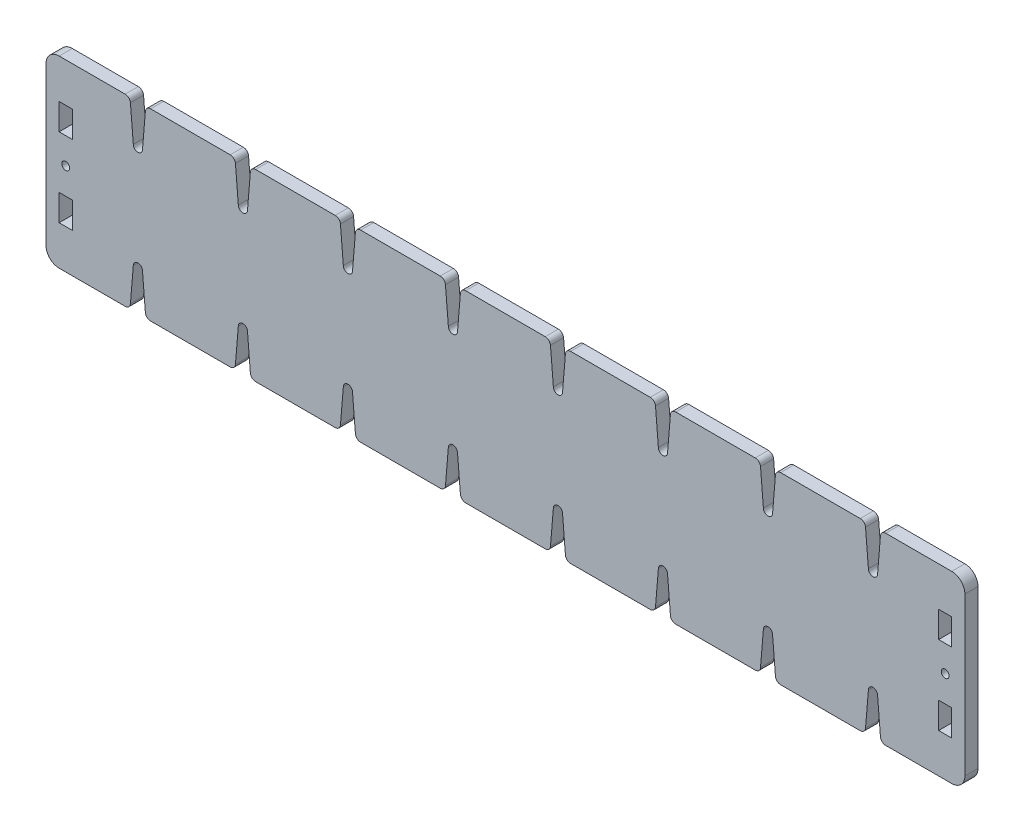
from build123d import *

# Parameters (mm, degrees)
SKETCH1_W           = 350
SKETCH1_H           = 70
SKETCH1_R           = 1.5
SKETCH1_W_2         = 5
SKETCH1_H_2         = 10
BOSS_EXTRUDE1_DEPTH = 5
CUT_EXTRUDE1_DEPTH  = 5
FILLET1_R           = 2
CONG_1_R            = 5


with BuildPart() as part:
    # Sketch1 → Boss-Extrude1 (new body)
    with BuildSketch(Plane.XY):
        with Locations((89.186746988, 0)):
            Rectangle(SKETCH1_W, SKETCH1_H)
        with Locations((-78.313253012, 0)):
            Circle(SKETCH1_R, mode=Mode.SUBTRACT)
        with Locations(Location((256.686746988, 0, 0), (0, 0, 180))):
            Circle(SKETCH1_R, mode=Mode.SUBTRACT)
        with Locations((-78.313253012, -15)):
            Rectangle(SKETCH1_W_2, SKETCH1_H_2, mode=Mode.SUBTRACT)
        with Locations((-78.313253012, 15)):
            Rectangle(SKETCH1_W_2, SKETCH1_H_2, mode=Mode.SUBTRACT)
        with Locations((256.686746988, -15)):
            Rectangle(SKETCH1_W_2, SKETCH1_H_2, mode=Mode.SUBTRACT)
        with Locations((256.686746988, 15)):
            Rectangle(SKETCH1_W_2, SKETCH1_H_2, mode=Mode.SUBTRACT)
    extrude(amount=BOSS_EXTRUDE1_DEPTH)

    # Sketch2 → Cut-Extrude1 (cut)
    with BuildSketch(Plane.XY.offset(5)):
        with BuildLine():
            Line((-53.813253012, 35), (-47.813253012, 35))
            Line((-47.813253012, 35), (-49.063253012, 20))
            ThreePointArc((-49.063253012, 20), (-50.813253012, 18.25), (-52.563253012, 20))
            Line((-52.563253012, 20), (-53.813253012, 35))
        make_face()
        with BuildLine():
            Line((-13.813253012, 35), (-7.813253012, 35))
            Line((-7.813253012, 35), (-9.063253012, 20))
            ThreePointArc((-9.063253012, 20), (-10.813253012, 18.25), (-12.563253012, 20))
            Line((-12.563253012, 20), (-13.813253012, 35))
        make_face()
        with BuildLine():
            Line((26.186746988, 35), (32.186746988, 35))
            Line((32.186746988, 35), (30.936746988, 20))
            ThreePointArc((30.936746988, 20), (29.186746988, 18.25), (27.436746988, 20))
            Line((27.436746988, 20), (26.186746988, 35))
        make_face()
        with BuildLine():
            Line((66.186746988, 35), (72.186746988, 35))
            Line((72.186746988, 35), (70.936746988, 20))
            ThreePointArc((70.936746988, 20), (69.186746988, 18.25), (67.436746988, 20))
            Line((67.436746988, 20), (66.186746988, 35))
        make_face()
        with BuildLine():
            Line((106.186746988, 35), (112.186746988, 35))
            Line((112.186746988, 35), (110.936746988, 20))
            ThreePointArc((110.936746988, 20), (109.186746988, 18.25), (107.436746988, 20))
            Line((107.436746988, 20), (106.186746988, 35))
        make_face()
        with BuildLine():
            Line((146.186746988, 35), (152.186746988, 35))
            Line((152.186746988, 35), (150.936746988, 20))
            ThreePointArc((150.936746988, 20), (149.186746988, 18.25), (147.436746988, 20))
            Line((147.436746988, 20), (146.186746988, 35))
        make_face()
        with BuildLine():
            Line((186.186746988, 35), (192.186746988, 35))
            Line((192.186746988, 35), (190.936746988, 20))
            ThreePointArc((190.936746988, 20), (189.186746988, 18.25), (187.436746988, 20))
            Line((187.436746988, 20), (186.186746988, 35))
        make_face()
        with BuildLine():
            Line((226.186746988, 35), (232.186746988, 35))
            Line((232.186746988, 35), (230.936746988, 20))
            ThreePointArc((230.936746988, 20), (229.186746988, 18.25), (227.436746988, 20))
            Line((227.436746988, 20), (226.186746988, 35))
        make_face()
        with BuildLine():
            Line((232.186746988, -35), (230.936746988, -20))
            ThreePointArc((230.936746988, -20), (229.186746988, -18.25), (227.436746988, -20))
            Line((227.436746988, -20), (226.186746988, -35))
            Line((226.186746988, -35), (232.186746988, -35))
        make_face()
        with BuildLine():
            Line((192.186746988, -35), (190.936746988, -20))
            ThreePointArc((190.936746988, -20), (189.186746988, -18.25), (187.436746988, -20))
            Line((187.436746988, -20), (186.186746988, -35))
            Line((186.186746988, -35), (192.186746988, -35))
        make_face()
        with BuildLine():
            Line((152.186746988, -35), (150.936746988, -20))
            ThreePointArc((150.936746988, -20), (149.186746988, -18.25), (147.436746988, -20))
            Line((147.436746988, -20), (146.186746988, -35))
            Line((146.186746988, -35), (152.186746988, -35))
        make_face()
        with BuildLine():
            Line((112.186746988, -35), (110.936746988, -20))
            ThreePointArc((110.936746988, -20), (109.186746988, -18.25), (107.436746988, -20))
            Line((107.436746988, -20), (106.186746988, -35))
            Line((106.186746988, -35), (112.186746988, -35))
        make_face()
        with BuildLine():
            Line((72.186746988, -35), (70.936746988, -20))
            ThreePointArc((70.936746988, -20), (69.186746988, -18.25), (67.436746988, -20))
            Line((67.436746988, -20), (66.186746988, -35))
            Line((66.186746988, -35), (72.186746988, -35))
        make_face()
        with BuildLine():
            Line((32.186746988, -35), (30.936746988, -20))
            ThreePointArc((30.936746988, -20), (29.186746988, -18.25), (27.436746988, -20))
            Line((27.436746988, -20), (26.186746988, -35))
            Line((26.186746988, -35), (32.186746988, -35))
        make_face()
        with BuildLine():
            Line((-7.813253012, -35), (-9.063253012, -20))
            ThreePointArc((-9.063253012, -20), (-10.813253012, -18.25), (-12.563253012, -20))
            Line((-12.563253012, -20), (-13.813253012, -35))
            Line((-13.813253012, -35), (-7.813253012, -35))
        make_face()
        with BuildLine():
            Line((-47.813253012, -35), (-49.063253012, -20))
            ThreePointArc((-49.063253012, -20), (-50.813253012, -18.25), (-52.563253012, -20))
            Line((-52.563253012, -20), (-53.813253012, -35))
            Line((-53.813253012, -35), (-47.813253012, -35))
        make_face()
    extrude(amount=-CUT_EXTRUDE1_DEPTH, mode=Mode.SUBTRACT)

    # Fillet1
    fillet1_edges = [part.edges().sort_by_distance(p)[0] for p in [
        (-13.813253012, 35, 2.5),
        (-7.813253012, 35, 2.5),
        (26.186746988, 35, 2.5),
        (32.186746988, 35, 2.5),
        (66.186746988, 35, 2.5),
        (72.186746988, 35, 2.5),
        (106.186746988, 35, 2.5),
        (112.186746988, 35, 2.5),
        (146.186746988, 35, 2.5),
        (152.186746988, 35, 2.5),
        (186.186746988, 35, 2.5),
        (192.186746988, 35, 2.5),
        (226.186746988, 35, 2.5),
        (232.186746988, 35, 2.5),
        (232.186746988, -35, 2.5),
        (226.186746988, -35, 2.5),
        (192.186746988, -35, 2.5),
        (186.186746988, -35, 2.5),
        (152.186746988, -35, 2.5),
        (146.186746988, -35, 2.5),
        (112.186746988, -35, 2.5),
        (106.186746988, -35, 2.5),
        (72.186746988, -35, 2.5),
        (66.186746988, -35, 2.5),
        (32.186746988, -35, 2.5),
        (26.186746988, -35, 2.5),
        (-7.813253012, -35, 2.5),
        (-13.813253012, -35, 2.5),
        (-47.813253012, -35, 2.5),
        (-53.813253012, -35, 2.5),
        (-53.813253012, 35, 2.5),
        (-47.813253012, 35, 2.5),
    ]]
    fillet(fillet1_edges, radius=FILLET1_R)

    # Congé1
    cong_1_edges = [part.edges().sort_by_distance(p)[0] for p in [
        (-85.813253012, 35, 2.5),
        (264.186746988, 35, 2.5),
        (264.186746988, -35, 2.5),
        (-85.813253012, -35, 2.5),
    ]]
    fillet(cong_1_edges, radius=CONG_1_R)


solid = part.part
